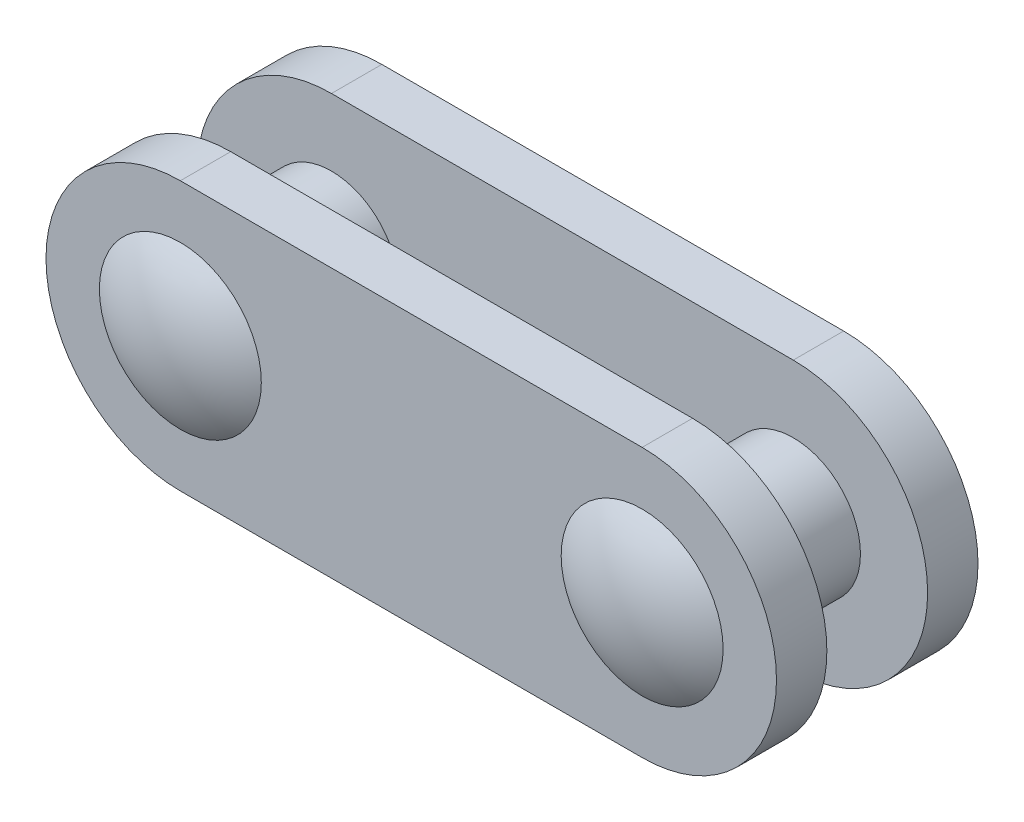
from build123d import *

# Parameters (mm, degrees)
EXTRUDE_1_DEPTH          = 6
EXTRUDE_1_DEPTH_BACK     = 6
CUT_EXTRUDE_1_DEPTH      = 3
CUT_EXTRUDE_1_DEPTH_BACK = 3
SKETCH_4_R               = 4


with BuildPart() as part:
    # 草图1 → 凸台-拉伸1 (new, two sides: drawn at the far end of the back side and taken through both)
    with BuildSketch(Plane.XY.offset(-EXTRUDE_1_DEPTH_BACK)):
        with BuildLine():
            Line((0, -8), (27.5, -8))
            ThreePointArc((27.5, -8), (35.5, 0), (27.5, 8))
            Line((27.5, 8), (0, 8))
            ThreePointArc((0, 8), (-8, 0), (0, -8))
        make_face()
    extrude(amount=EXTRUDE_1_DEPTH + EXTRUDE_1_DEPTH_BACK)

    # 草图2 → 旋转1 (revolve)
    with BuildSketch(Plane(origin=(0, 0, 0), x_dir=(0, 0, -1), z_dir=(1, 0, 0))):
        with BuildLine():
            Line((-6, 4.82182538), (-6, 4))
            Line((-6, 4), (6, 4))
            Line((6, 4), (6, 4.5))
            Line((6, 4.5), (7, 4.5))
            Line((7, 4.5), (7, 0))
            Line((7, 0), (-7.5, 0))
            ThreePointArc((-7.5, 0), (-7.11634154, 2.524876235), (-6, 4.82182538))
        make_face()
    revolve(axis=Axis((0, 0, -7), (0, 0, 1)))

    # 草图3 → 旋转2 (revolve)
    with BuildSketch(Plane(origin=(27.5, 0, 0), x_dir=(0, 0, -1), z_dir=(1, 0, 0))):
        with BuildLine():
            Line((-6, 4.82182538), (-6, 4))
            Line((-6, 4), (6, 4))
            Line((6, 4), (6, 4.5))
            Line((6, 4.5), (7, 4.5))
            Line((7, 4.5), (7, 0))
            Line((7, 0), (-7.5, 0))
            ThreePointArc((-7.5, 0), (-7.11634154, 2.524876235), (-6, 4.82182538))
        make_face()
    revolve(axis=Axis((27.5, 0, -7), (0, 0, 1)))

    # 草图4 → 切除-拉伸1 (cut, two sides: drawn at the far end of the back side and taken through both)
    with BuildSketch(Plane.XY.offset(-CUT_EXTRUDE_1_DEPTH_BACK)):
        with BuildLine():
            Line((0, -8), (27.5, -8))
            ThreePointArc((27.5, -8), (35.5, 0), (27.5, 8))
            Line((27.5, 8), (0, 8))
            ThreePointArc((0, 8), (-8, 0), (0, -8))
        make_face()
        with Locations((27.5, 0)):
            Circle(SKETCH_4_R, mode=Mode.SUBTRACT)
        Circle(SKETCH_4_R, mode=Mode.SUBTRACT)
    extrude(amount=CUT_EXTRUDE_1_DEPTH + CUT_EXTRUDE_1_DEPTH_BACK, mode=Mode.SUBTRACT)


solid = part.part
